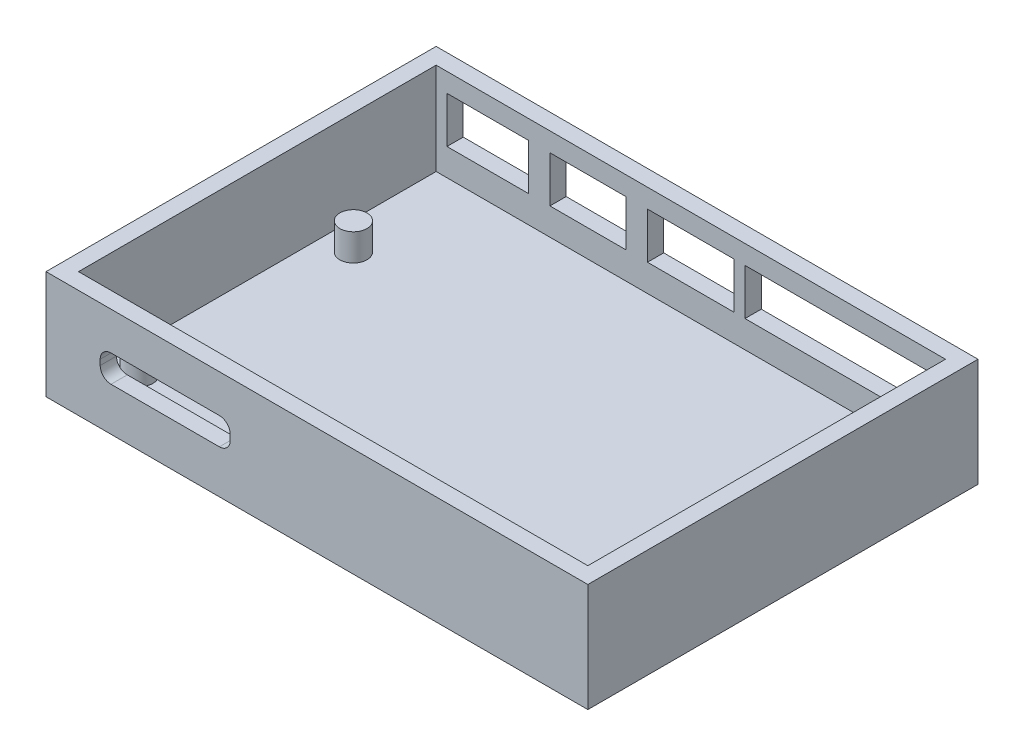
from build123d import *

# Parameters (mm, degrees)
SKETCH1_W           = 100
SKETCH1_H           = 72
BOSS_EXTRUDE1_DEPTH = 20
SKETCH2_W           = 94
SKETCH2_H           = 66
CUT_EXTRUDE1_DEPTH  = 17
SKETCH3_R           = 2.5
BOSS_EXTRUDE2_DEPTH = 5
SKETCH6_W           = 36
SKETCH6_H           = 8.5
SKETCH6_W_2         = 14
SKETCH6_W_3         = 16
SKETCH6_W_4         = 15
BOSS_EXTRUDE4_DEPTH = 12
SKETCH6_6_W         = 36
SKETCH6_6_H         = 8.5
SKETCH6_6_W_2       = 14
SKETCH6_6_W_3       = 16
SKETCH6_6_W_4       = 15
CUT_EXTRUDE2_DEPTH  = 18
CUT_EXTRUDE4_DEPTH  = 18


with BuildPart() as part:
    # Sketch1 → Boss-Extrude1 (new body)
    with BuildSketch(Plane(origin=(0, 0, 0), x_dir=(1, 0, 0), z_dir=(0, 1, 0))):
        with Locations((0.803212851, 7.285140562)):
            Rectangle(SKETCH1_W, SKETCH1_H)
    extrude(amount=BOSS_EXTRUDE1_DEPTH)

    # Sketch2 → Cut-Extrude1 (cut)
    with BuildSketch(Plane(origin=(0, 20, 0), x_dir=(1, 0, 0), z_dir=(0, 1, 0))):
        with Locations((0.803212851, 7.285140562)):
            Rectangle(SKETCH2_W, SKETCH2_H)
    extrude(amount=-CUT_EXTRUDE1_DEPTH, mode=Mode.SUBTRACT)

    # Sketch3 → Boss-Extrude2 (add)
    with BuildSketch(Plane(origin=(0, 3, 0), x_dir=(1, 0, 0), z_dir=(0, 1, 0))):
        with Locations((-40.962789341, -19.714859438)):
            Circle(SKETCH3_R)
        with Locations((-40.962789341, 19.785140562)):
            Circle(SKETCH3_R)
        with Locations((43.037210659, -17.714859438)):
            Circle(SKETCH3_R)
        with Locations((43.037210659, 19.785140562)):
            Circle(SKETCH3_R)
    extrude(amount=BOSS_EXTRUDE2_DEPTH)

    # Sketch6 → Boss-Extrude4 (add)
    with BuildSketch(Plane(origin=(0, 0, -43.285140562), x_dir=(-1, 0, 0), z_dir=(0, 0, -1))):
        with Locations((-28.803212851, 12.25)):
            Rectangle(SKETCH6_W, SKETCH6_H)
        with Locations((18.196787149, 12.25)):
            Rectangle(SKETCH6_W_2, SKETCH6_H)
        with Locations((-0.803212851, 12.25)):
            Rectangle(SKETCH6_W_3, SKETCH6_H)
        with Locations((36.696787149, 12.25)):
            Rectangle(SKETCH6_W_4, SKETCH6_H)
    extrude(amount=-BOSS_EXTRUDE4_DEPTH)

    # Sketch6<6> → Cut-Extrude2 (cut)
    with BuildSketch(Plane(origin=(0, 0, -43.285140562), x_dir=(-1, 0, 0), z_dir=(0, 0, -1))):
        with Locations((-28.803212851, 12.25)):
            Rectangle(SKETCH6_6_W, SKETCH6_6_H)
        with Locations((18.196787149, 12.25)):
            Rectangle(SKETCH6_6_W_2, SKETCH6_6_H)
        with Locations((-0.803212851, 12.25)):
            Rectangle(SKETCH6_6_W_3, SKETCH6_6_H)
        with Locations((36.696787149, 12.25)):
            Rectangle(SKETCH6_6_W_4, SKETCH6_6_H)
    extrude(amount=-CUT_EXTRUDE2_DEPTH, mode=Mode.SUBTRACT)

    # usb type-c → Cut-Extrude4 (cut)
    with BuildSketch(Plane.XY.offset(28.714859438)):
        with BuildLine():
            Line((-37.196787149, 13), (-17.196787149, 13))
            ThreePointArc((-17.196787149, 13), (-15.782573586, 12.414213562), (-15.196787149, 11))
            Line((-15.196787149, 11), (-15.196787149, 10))
            ThreePointArc((-15.196787149, 10), (-15.782573586, 8.585786438), (-17.196787149, 8))
            Line((-17.196787149, 8), (-37.196787149, 8))
            ThreePointArc((-37.196787149, 8), (-38.611000711, 8.585786438), (-39.196787149, 10))
            Line((-39.196787149, 10), (-39.196787149, 11))
            ThreePointArc((-39.196787149, 11), (-38.611000711, 12.414213562), (-37.196787149, 13))
        make_face()
    extrude(amount=-CUT_EXTRUDE4_DEPTH, mode=Mode.SUBTRACT)


solid = part.part
